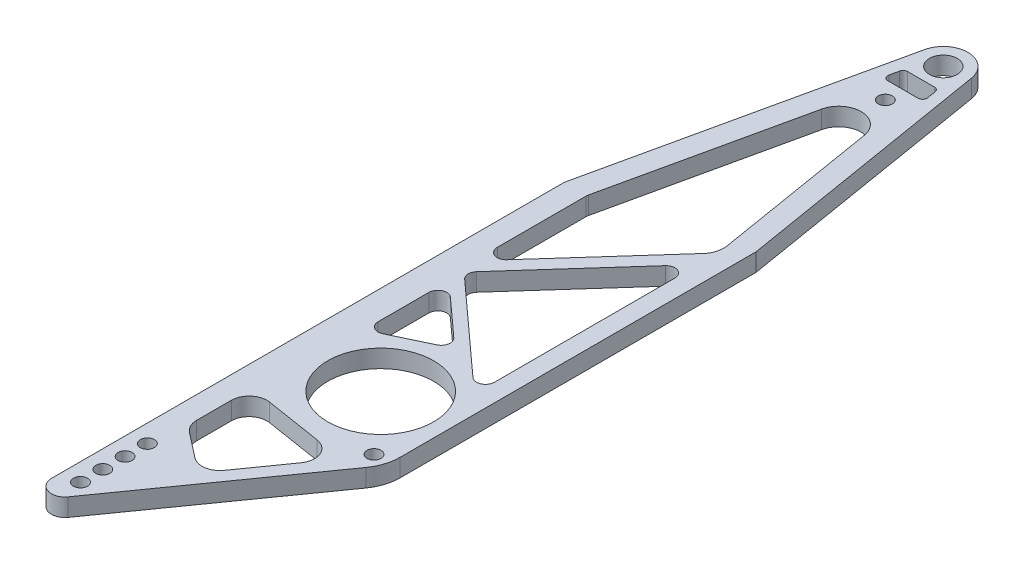
from build123d import *

# Parameters (mm, degrees)
SKETCH11_R          = 3.96875
SKETCH11_R_2        = 15.08125
SKETCH11_R_3        = 2
BOSS_EXTRUDE2_DEPTH = 5.08


with BuildPart() as part:
    # Sketch11 → Boss-Extrude2 (new body)
    with BuildSketch(Plane(origin=(0, 0, 0), x_dir=(1, 0, 0), z_dir=(0, 1, 0))):
        with BuildLine():
            Line((19.05, -173.758834345), (19.05, -72.598586407))
            ThreePointArc((19.05, -72.598586407), (19.041478453, -72.390699795), (19.015970989, -72.184208077))
            Line((19.015970989, -72.184208077), (6.891420221, 1.139540409))
            ThreePointArc((6.891420221, 1.139540409), (0.187396777, 6.982485764), (-6.820377584, 1.507539257))
            Line((-6.820377584, 1.507539257), (-25.340137303, -82.279170439))
            ThreePointArc((-25.340137303, -82.279170439), (-25.384989975, -82.551639086), (-25.4, -82.827366533))
            Line((-25.4, -82.827366533), (-25.4, -177.8))
            Line((-25.4, -177.8), (-25.4, -228.6))
            ThreePointArc((-25.4, -228.6), (-22.745272537, -232.230626029), (-18.480606107, -230.801765114))
            Line((-18.480606107, -230.801765114), (16.71464631, -181.098051393))
            ThreePointArc((16.71464631, -181.098051393), (18.452086765, -177.609742801), (19.05, -173.758834345))
        make_face()
        with Locations(Location((0, 0, 0), (0, 0, 270))):
            Circle(SKETCH11_R, mode=Mode.SUBTRACT)
        with Locations(Location((0, -160.246508934, 0), (0, 0, 270))):
            Circle(SKETCH11_R_2, mode=Mode.SUBTRACT)
        with Locations(Location((-20.32, -225.425, 0), (0, 0, 270))):
            Circle(SKETCH11_R_3, mode=Mode.SUBTRACT)
        with Locations(Location((-20.32, -219.075, 0), (0, 0, 270))):
            Circle(SKETCH11_R_3, mode=Mode.SUBTRACT)
        with Locations(Location((-20.32, -212.725, 0), (0, 0, 270))):
            Circle(SKETCH11_R_3, mode=Mode.SUBTRACT)
        with Locations(Location((-20.32, -206.375, 0), (0, 0, 270))):
            Circle(SKETCH11_R_3, mode=Mode.SUBTRACT)
        with Locations(Location((0, -16.51, 0), (0, 0, 270))):
            Circle(SKETCH11_R_3, mode=Mode.SUBTRACT)
        with Locations(Location((14.605, -176.756508934, 0), (0, 0, 270))):
            Circle(SKETCH11_R_3, mode=Mode.SUBTRACT)
        with BuildLine():
            Line((11.940278596, -80.334093652), (-14.464036902, -109.837128051))
            ThreePointArc((-14.464036902, -109.837128051), (-17.263416449, -110.515885849), (-18.896731016, -108.143224574))
            Line((-18.896731016, -108.143224574), (-18.896731016, -82.827366533))
            ThreePointArc((-18.896731016, -82.827366533), (-18.881720992, -82.551639086), (-18.83686832, -82.279170439))
            Line((-18.83686832, -82.279170439), (-6.80244992, -27.833306339))
            ThreePointArc((-6.80244992, -27.833306339), (-0.402909414, -22.833553189), (5.719243979, -28.169365038))
            Line((5.719243979, -28.169365038), (13.473470783, -75.063389134))
            ThreePointArc((13.473470783, -75.063389134), (13.305815609, -77.87296697), (11.940278596, -80.334093652))
        make_face(mode=Mode.SUBTRACT)
        with BuildLine():
            Line((13.97, -141.812492878), (13.97, -90.426050798))
            ThreePointArc((13.97, -90.426050798), (12.336685433, -88.053389523), (9.537305885, -88.732147321))
            Line((9.537305885, -88.732147321), (-15.843545445, -117.091607347))
            ThreePointArc((-15.843545445, -117.091607347), (-16.487420873, -118.917476564), (-15.657551613, -120.666673802))
            Line((-15.657551613, -120.666673802), (9.723299718, -143.693655856))
            ThreePointArc((9.723299718, -143.693655856), (12.458732541, -144.134842843), (13.97, -141.812492878))
        make_face(mode=Mode.SUBTRACT)
        with BuildLine():
            Line((-13.279299718, -127.111337727), (-2.809524218, -136.610125984))
            ThreePointArc((-2.809524218, -136.610125984), (-2.003545388, -138.86283126), (-3.426980373, -140.785879825))
            Line((-3.426980373, -140.785879825), (-13.896755873, -145.755890669))
            ThreePointArc((-13.896755873, -145.755890669), (-16.343372447, -145.60819059), (-17.526, -143.461299805))
            Line((-17.526, -143.461299805), (-17.526, -128.992500705))
            ThreePointArc((-17.526, -128.992500705), (-16.014732541, -126.67015074), (-13.279299718, -127.111337727))
        make_face(mode=Mode.SUBTRACT)
        with BuildLine():
            Line((6.282161105, -189.238159376), (-2.779804772, -202.035719466))
            ThreePointArc((-2.779804772, -202.035719466), (-6.184281083, -204.125642303), (-10.047215475, -203.107814076))
            Line((-10.047215475, -203.107814076), (-17.09155218, -197.621171408))
            ThreePointArc((-17.09155218, -197.621171408), (-18.534202289, -195.843739158), (-19.05, -193.613389978))
            Line((-19.05, -193.613389978), (-19.05, -183.748869713))
            ThreePointArc((-19.05, -183.748869713), (-17.268890157, -179.885746141), (-13.174518217, -178.731538875))
            Line((-13.174518217, -178.731538875), (2.931784364, -181.28514172))
            ThreePointArc((2.931784364, -181.28514172), (6.817844364, -184.330274157), (6.282161105, -189.238159376))
        make_face(mode=Mode.SUBTRACT)
        with BuildLine():
            Line((3.834506832, -6.35), (-3.834506832, -6.35))
            ThreePointArc((-3.834506832, -6.35), (-4.629741225, -6.629796859), (-5.074575483, -7.345901953))
            Line((-5.074575483, -7.345901953), (-5.636003302, -9.885901953))
            ThreePointArc((-5.636003302, -9.885901953), (-5.386137791, -10.955234393), (-4.395934651, -11.43))
            Line((-4.395934651, -11.43), (4.254512077, -11.43))
            ThreePointArc((4.254512077, -11.43), (5.223023884, -10.981513774), (5.507497571, -9.952810835))
            Line((5.507497571, -9.952810835), (5.087492326, -7.412810835))
            ThreePointArc((5.087492326, -7.412810835), (4.656020605, -6.651488193), (3.834506832, -6.35))
        make_face(mode=Mode.SUBTRACT)
    extrude(amount=-BOSS_EXTRUDE2_DEPTH)


solid = part.part
